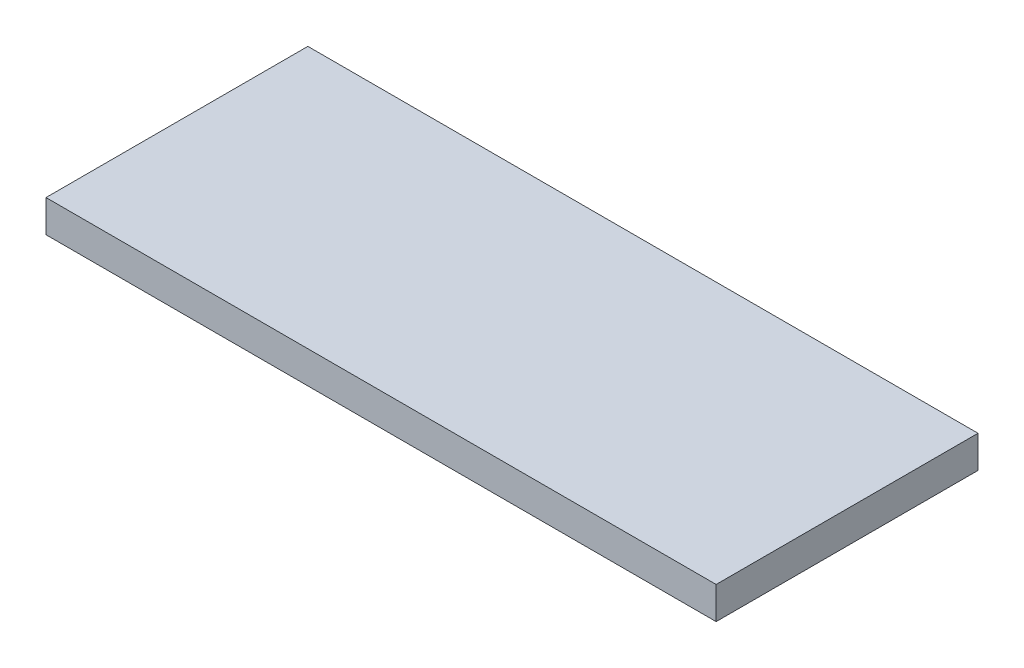
from build123d import *

# Parameters (mm, degrees)
SKETCH1_W           = 65
SKETCH1_H           = 25.4
BOSS_EXTRUDE1_DEPTH = 3.125


with BuildPart() as part:
    # Sketch1 → Boss-Extrude1 (new body)
    with BuildSketch(Plane(origin=(0, 0, 0), x_dir=(1, 0, 0), z_dir=(0, 1, 0))):
        Rectangle(SKETCH1_W, SKETCH1_H)
    extrude(amount=BOSS_EXTRUDE1_DEPTH)


solid = part.part
